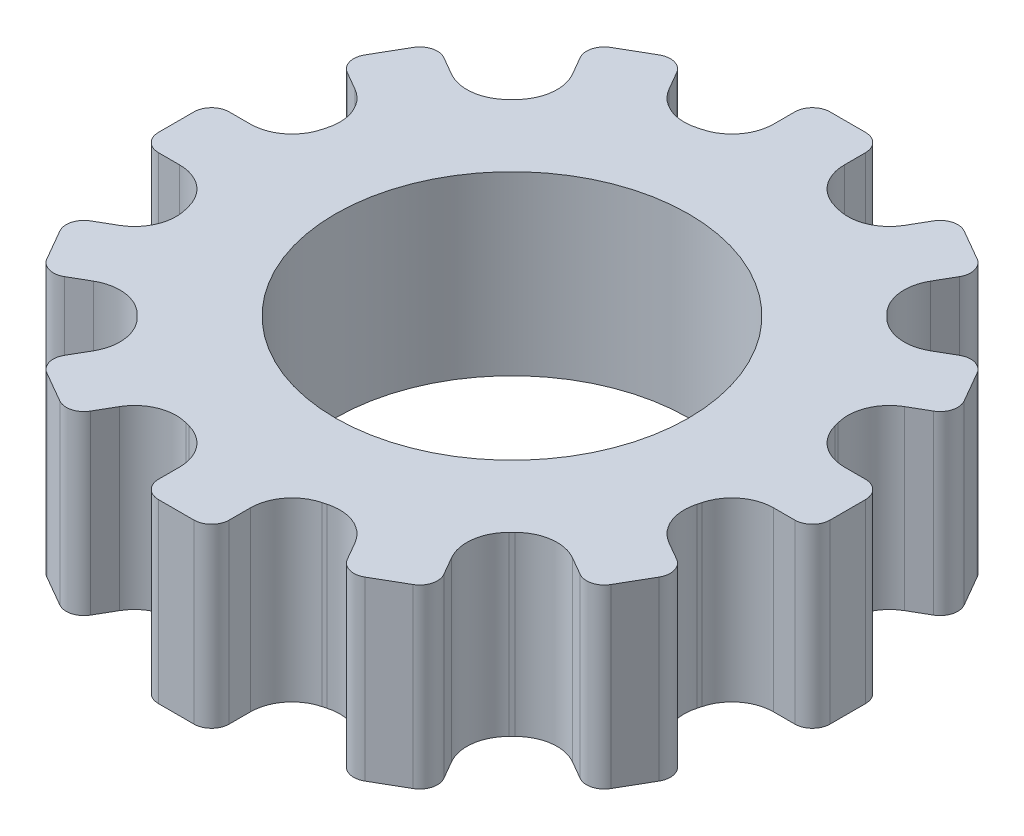
from build123d import *

# Parameters (mm, degrees)
SKETCH1_R           = 6.35
BOSS_EXTRUDE1_DEPTH = 6.35


with BuildPart() as part:
    # Sketch1 → Boss-Extrude1 (new body)
    with BuildSketch(Plane(origin=(0, 0, 0), x_dir=(1, 0, 0), z_dir=(0, 1, 0))):
        with BuildLine():
            Line((-1.27, 10.670267616), (-1.27, 11.43))
            ThreePointArc((-1.27, 11.43), (-1.084012806, 11.879012806), (-0.635, 12.065))
            Line((-0.635, 12.065), (0.635, 12.065))
            ThreePointArc((0.635, 12.065), (1.084012806, 11.879012806), (1.27, 11.43))
            Line((1.27, 11.43), (1.27, 10.670267616))
            ThreePointArc((1.27, 10.670267616), (1.583306834, 9.753271395), (2.392223502, 9.219701281))
            Line((2.392223502, 9.219701281), (2.538124316, 9.180607276))
            ThreePointArc((2.538124316, 9.180607276), (3.505451757, 9.238234215), (4.235281545, 9.875722821))
            Line((4.235281545, 9.875722821), (4.615147737, 10.533670365))
            ThreePointArc((4.615147737, 10.533670365), (5.000723775, 10.829533265), (5.482573869, 10.766096497))
            Line((5.482573869, 10.766096497), (6.582426131, 10.131096497))
            ThreePointArc((6.582426131, 10.131096497), (6.878289031, 9.745520459), (6.814852263, 9.263670365))
            Line((6.814852263, 9.263670365), (6.434986071, 8.605722821))
            ThreePointArc((6.434986071, 8.605722821), (6.247819637, 7.654927381), (6.681576965, 6.788383774))
            Line((6.681576965, 6.788383774), (6.788383774, 6.681576965))
            ThreePointArc((6.788383774, 6.681576965), (7.654927381, 6.247819637), (8.605722821, 6.434986071))
            Line((8.605722821, 6.434986071), (9.263670365, 6.814852263))
            ThreePointArc((9.263670365, 6.814852263), (9.745520459, 6.878289031), (10.131096497, 6.582426131))
            Line((10.131096497, 6.582426131), (10.766096497, 5.482573869))
            ThreePointArc((10.766096497, 5.482573869), (10.829533265, 5.000723775), (10.533670365, 4.615147737))
            Line((10.533670365, 4.615147737), (9.875722821, 4.235281545))
            ThreePointArc((9.875722821, 4.235281545), (9.238234215, 3.505451757), (9.180607276, 2.538124316))
            Line((9.180607276, 2.538124316), (9.219701281, 2.392223502))
            ThreePointArc((9.219701281, 2.392223502), (9.753271395, 1.583306834), (10.670267616, 1.27))
            Line((10.670267616, 1.27), (11.43, 1.27))
            ThreePointArc((11.43, 1.27), (11.879012806, 1.084012806), (12.065, 0.635))
            Line((12.065, 0.635), (12.065, -0.635))
            ThreePointArc((12.065, -0.635), (11.879012806, -1.084012806), (11.43, -1.27))
            Line((11.43, -1.27), (10.670267616, -1.27))
            ThreePointArc((10.670267616, -1.27), (9.753271395, -1.583306834), (9.219701281, -2.392223502))
            Line((9.219701281, -2.392223502), (9.180607276, -2.538124316))
            ThreePointArc((9.180607276, -2.538124316), (9.238234215, -3.505451757), (9.875722821, -4.235281545))
            Line((9.875722821, -4.235281545), (10.533670365, -4.615147737))
            ThreePointArc((10.533670365, -4.615147737), (10.829533265, -5.000723775), (10.766096497, -5.482573869))
            Line((10.766096497, -5.482573869), (10.131096497, -6.582426131))
            ThreePointArc((10.131096497, -6.582426131), (9.745520459, -6.878289031), (9.263670365, -6.814852263))
            Line((9.263670365, -6.814852263), (8.605722821, -6.434986071))
            ThreePointArc((8.605722821, -6.434986071), (7.654927381, -6.247819637), (6.788383774, -6.681576965))
            Line((6.788383774, -6.681576965), (6.681576965, -6.788383774))
            ThreePointArc((6.681576965, -6.788383774), (6.247819637, -7.654927381), (6.434986071, -8.605722821))
            Line((6.434986071, -8.605722821), (6.814852263, -9.263670365))
            ThreePointArc((6.814852263, -9.263670365), (6.878289031, -9.745520459), (6.582426131, -10.131096497))
            Line((6.582426131, -10.131096497), (5.482573869, -10.766096497))
            ThreePointArc((5.482573869, -10.766096497), (5.000723775, -10.829533265), (4.615147737, -10.533670365))
            Line((4.615147737, -10.533670365), (4.235281545, -9.875722821))
            ThreePointArc((4.235281545, -9.875722821), (3.505451757, -9.238234215), (2.538124316, -9.180607276))
            Line((2.538124316, -9.180607276), (2.392223502, -9.219701281))
            ThreePointArc((2.392223502, -9.219701281), (1.583306834, -9.753271395), (1.27, -10.670267616))
            Line((1.27, -10.670267616), (1.27, -11.43))
            ThreePointArc((1.27, -11.43), (1.084012806, -11.879012806), (0.635, -12.065))
            Line((0.635, -12.065), (-0.635, -12.065))
            ThreePointArc((-0.635, -12.065), (-1.084012806, -11.879012806), (-1.27, -11.43))
            Line((-1.27, -11.43), (-1.27, -10.670267616))
            ThreePointArc((-1.27, -10.670267616), (-1.583306834, -9.753271395), (-2.392223502, -9.219701281))
            Line((-2.392223502, -9.219701281), (-2.538124316, -9.180607276))
            ThreePointArc((-2.538124316, -9.180607276), (-3.505451757, -9.238234215), (-4.235281545, -9.875722821))
            Line((-4.235281545, -9.875722821), (-4.615147737, -10.533670365))
            ThreePointArc((-4.615147737, -10.533670365), (-5.000723775, -10.829533265), (-5.482573869, -10.766096497))
            Line((-5.482573869, -10.766096497), (-6.582426131, -10.131096497))
            ThreePointArc((-6.582426131, -10.131096497), (-6.878289031, -9.745520459), (-6.814852263, -9.263670365))
            Line((-6.814852263, -9.263670365), (-6.434986071, -8.605722821))
            ThreePointArc((-6.434986071, -8.605722821), (-6.247819637, -7.654927381), (-6.681576965, -6.788383774))
            Line((-6.681576965, -6.788383774), (-6.788383774, -6.681576965))
            ThreePointArc((-6.788383774, -6.681576965), (-7.654927381, -6.247819637), (-8.605722821, -6.434986071))
            Line((-8.605722821, -6.434986071), (-9.263670365, -6.814852263))
            ThreePointArc((-9.263670365, -6.814852263), (-9.745520459, -6.878289031), (-10.131096497, -6.582426131))
            Line((-10.131096497, -6.582426131), (-10.766096497, -5.482573869))
            ThreePointArc((-10.766096497, -5.482573869), (-10.829533265, -5.000723775), (-10.533670365, -4.615147737))
            Line((-10.533670365, -4.615147737), (-9.875722821, -4.235281545))
            ThreePointArc((-9.875722821, -4.235281545), (-9.238234215, -3.505451757), (-9.180607276, -2.538124316))
            Line((-9.180607276, -2.538124316), (-9.219701281, -2.392223502))
            ThreePointArc((-9.219701281, -2.392223502), (-9.753271395, -1.583306834), (-10.670267616, -1.27))
            Line((-10.670267616, -1.27), (-11.43, -1.27))
            ThreePointArc((-11.43, -1.27), (-11.879012806, -1.084012806), (-12.065, -0.635))
            Line((-12.065, -0.635), (-12.065, 0.635))
            ThreePointArc((-12.065, 0.635), (-11.879012806, 1.084012806), (-11.43, 1.27))
            Line((-11.43, 1.27), (-10.670267616, 1.27))
            ThreePointArc((-10.670267616, 1.27), (-9.753271395, 1.583306834), (-9.219701281, 2.392223502))
            Line((-9.219701281, 2.392223502), (-9.180607276, 2.538124316))
            ThreePointArc((-9.180607276, 2.538124316), (-9.238234215, 3.505451757), (-9.875722821, 4.235281545))
            Line((-9.875722821, 4.235281545), (-10.533670365, 4.615147737))
            ThreePointArc((-10.533670365, 4.615147737), (-10.829533265, 5.000723775), (-10.766096497, 5.482573869))
            Line((-10.766096497, 5.482573869), (-10.131096497, 6.582426131))
            ThreePointArc((-10.131096497, 6.582426131), (-9.745520459, 6.878289031), (-9.263670365, 6.814852263))
            Line((-9.263670365, 6.814852263), (-8.605722821, 6.434986071))
            ThreePointArc((-8.605722821, 6.434986071), (-7.654927381, 6.247819637), (-6.788383774, 6.681576965))
            Line((-6.788383774, 6.681576965), (-6.681576965, 6.788383774))
            ThreePointArc((-6.681576965, 6.788383774), (-6.247819637, 7.654927381), (-6.434986071, 8.605722821))
            Line((-6.434986071, 8.605722821), (-6.814852263, 9.263670365))
            ThreePointArc((-6.814852263, 9.263670365), (-6.878289031, 9.745520459), (-6.582426131, 10.131096497))
            Line((-6.582426131, 10.131096497), (-5.482573869, 10.766096497))
            ThreePointArc((-5.482573869, 10.766096497), (-5.000723775, 10.829533265), (-4.615147737, 10.533670365))
            Line((-4.615147737, 10.533670365), (-4.235281545, 9.875722821))
            ThreePointArc((-4.235281545, 9.875722821), (-3.505451757, 9.238234215), (-2.538124316, 9.180607276))
            Line((-2.538124316, 9.180607276), (-2.392223502, 9.219701281))
            ThreePointArc((-2.392223502, 9.219701281), (-1.583306834, 9.753271395), (-1.27, 10.670267616))
        make_face()
        with Locations(Location((0, 0, 0), (0, 0, 270))):
            Circle(SKETCH1_R, mode=Mode.SUBTRACT)
    extrude(amount=BOSS_EXTRUDE1_DEPTH)


solid = part.part
